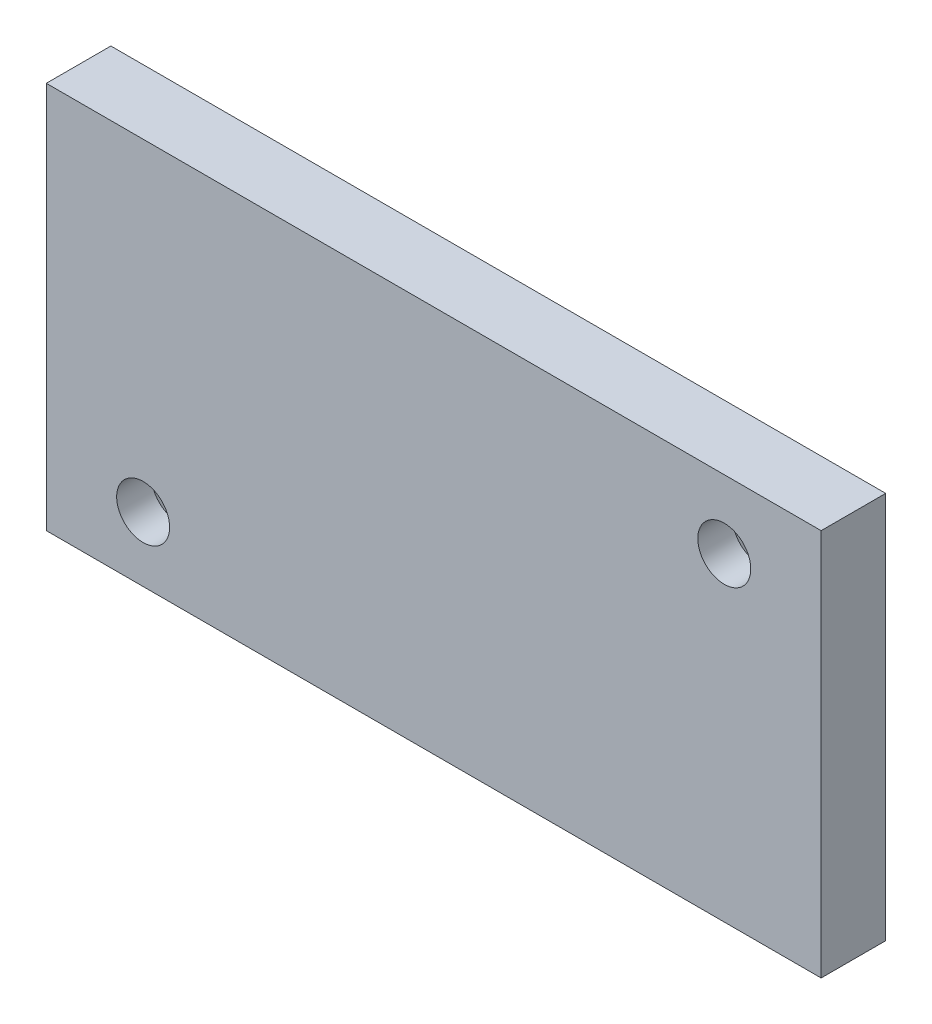
from build123d import *
from OCP.BRepFilletAPI import BRepFilletAPI_MakeChamfer

# Parameters (mm, degrees)
SKETCH1_W            = 76.2
SKETCH1_H            = 38.1
SKETCH1_R            = 2.6035
BOSS_EXTRUDE1_DEPTH  = 6.35
SKETCH4_R            = 2.6035
CUT_EXTRUDE1_DEPTH   = 0.635
SKETCH14_W           = 76.2
SKETCH14_H           = 38.1
SKETCH14_W_2         = 71.12
SKETCH14_H_2         = 33.02
BOSS_EXTRUDE10_DEPTH = 0.635
FILLET6_R            = 3.175
CUT_EXTRUDE4_DEPTH   = 1.27
CUT_EXTRUDE5_DEPTH   = 1.27
CHAMFER1_SIZE        = 1.016
CHAMFER1_SIZE2       = 0.473768581


with BuildPart() as part:
    # Sketch1 → Boss-Extrude1 (new body)
    with BuildSketch(Plane.XY.offset(17.78)):
        with Locations((-38.1, -19.05)):
            Rectangle(SKETCH1_W, SKETCH1_H)
        with Locations((-9.525, -6.731)):
            Circle(SKETCH1_R, mode=Mode.SUBTRACT)
        with Locations((-66.675, -31.75)):
            Circle(SKETCH1_R, mode=Mode.SUBTRACT)
    extrude(amount=BOSS_EXTRUDE1_DEPTH)

    # Sketch4 → Cut-Extrude1 (cut)
    # profile 1 of 2: a face of its own
    with BuildSketch(Plane(origin=(0, 0, 17.78), x_dir=(-1, 0, 0), z_dir=(0, 0, -1))):
        Polygon((0, 0), (0, -13.208), (76.2, -9.017), (76.2, 0), align=None)
        with Locations((9.525, -6.731)):
            Circle(SKETCH4_R, mode=Mode.SUBTRACT)
    # profile 2 of 2: a face of its own
    with BuildSketch(Plane(origin=(0, 0, 17.78), x_dir=(-1, 0, 0), z_dir=(0, 0, -1))):
        Polygon((76.2, -29.083), (0, -24.892), (0, -38.1), (76.2, -38.1), align=None)
        with Locations((66.675, -31.75)):
            Circle(SKETCH4_R, mode=Mode.SUBTRACT)
    extrude(amount=-CUT_EXTRUDE1_DEPTH, mode=Mode.SUBTRACT)

    # Sketch14 → Boss-Extrude10 (add, symmetric)
    with BuildSketch(Plane(origin=(0, 0, 18.415), x_dir=(-1, 0, 0), z_dir=(0, 0, -1))):
        with Locations((38.1, -19.05)):
            Rectangle(SKETCH14_W, SKETCH14_H)
        with Locations((38.1, -19.05)):
            Rectangle(SKETCH14_W_2, SKETCH14_H_2, mode=Mode.SUBTRACT)
    extrude(amount=BOSS_EXTRUDE10_DEPTH, both=True)

    # Fillet6
    fillet6_edges = [part.edges().sort_by_distance(p)[0] for p in [
        (-2.54, -13.0683, 18.0975),
        (-73.66, -9.1567, 18.0975),
        (-73.66, -2.54, 18.0975),
        (-2.54, -2.54, 18.0975),
        (-2.54, -25.0317, 18.0975),
        (-2.54, -35.56, 18.0975),
        (-73.66, -35.56, 18.0975),
        (-73.66, -28.9433, 18.0975),
    ]]
    fillet(fillet6_edges, radius=FILLET6_R)

    # Sketch17 → Cut-Extrude4 (cut)
    with BuildSketch(Plane(origin=(0, 0, 18.415), x_dir=(-1, 0, 0), z_dir=(0, 0, -1))):
        with BuildLine():
            Line((5.715, -2.54), (70.485, -2.54))
            ThreePointArc((70.485, -2.54), (72.73006403, -3.46993597), (73.66, -5.715))
            Line((73.66, -5.715), (73.66, -6.151526439))
            ThreePointArc((73.66, -6.151526439), (72.790886239, -8.334073954), (70.659361477, -9.321735119))
            Line((70.659361477, -9.321735119), (5.889361477, -12.884085119))
            ThreePointArc((5.889361477, -12.884085119), (3.532452485, -12.019762677), (2.54, -9.713876439))
            Line((2.54, -9.713876439), (2.54, -5.715))
            ThreePointArc((2.54, -5.715), (3.46993597, -3.46993597), (5.715, -2.54))
        make_face()
    extrude(amount=-CUT_EXTRUDE4_DEPTH, mode=Mode.SUBTRACT)

    # Sketch20 → Cut-Extrude5 (cut)
    with BuildSketch(Plane(origin=(0, 0, 18.415), x_dir=(-1, 0, 0), z_dir=(0, 0, -1))):
        with BuildLine():
            Line((5.889361477, -25.215914881), (70.659361477, -28.778264881))
            ThreePointArc((70.659361477, -28.778264881), (72.790886239, -29.765926046), (73.66, -31.948473561))
            Line((73.66, -31.948473561), (73.66, -32.385))
            ThreePointArc((73.66, -32.385), (72.73006403, -34.63006403), (70.485, -35.56))
            Line((70.485, -35.56), (5.715, -35.56))
            ThreePointArc((5.715, -35.56), (3.46993597, -34.63006403), (2.54, -32.385))
            Line((2.54, -32.385), (2.54, -28.386123561))
            ThreePointArc((2.54, -28.386123561), (3.532452485, -26.080237323), (5.889361477, -25.215914881))
        make_face()
    extrude(amount=-CUT_EXTRUDE5_DEPTH, mode=Mode.SUBTRACT)

    # Chamfer1: one chamfer whose edges measure the first distance from different faces: ONE call of the kernel's chamfer builder (chamfer() names one face for all edges)
    chamfer1_edges_1 = [part.edges().sort_by_distance(p)[0] for p in [
        (-12.1285, -6.731, 19.685),
    ]]
    chamfer1_side_1 = [part.faces().sort_by_distance(p)[0] for p in [
        (-12.1285, -6.731, 21.9075),
    ]]
    chamfer1_edges_2 = [part.edges().sort_by_distance(p)[0] for p in [
        (-69.2785, -31.75, 19.685),
    ]]
    chamfer1_side_2 = [part.faces().sort_by_distance(p)[0] for p in [
        (-69.2785, -31.75, 21.9075),
    ]]
    chamfer1 = BRepFilletAPI_MakeChamfer(part.part.solid().wrapped)
    for e in chamfer1_edges_1:
        chamfer1.Add(CHAMFER1_SIZE, CHAMFER1_SIZE2, e.wrapped, chamfer1_side_1[0].wrapped)  # the first distance lies on this face
    for e in chamfer1_edges_2:
        chamfer1.Add(CHAMFER1_SIZE, CHAMFER1_SIZE2, e.wrapped, chamfer1_side_2[0].wrapped)  # the first distance lies on this face
    add(Compound.cast(chamfer1.Shape()), mode=Mode.REPLACE)


solid = part.part
